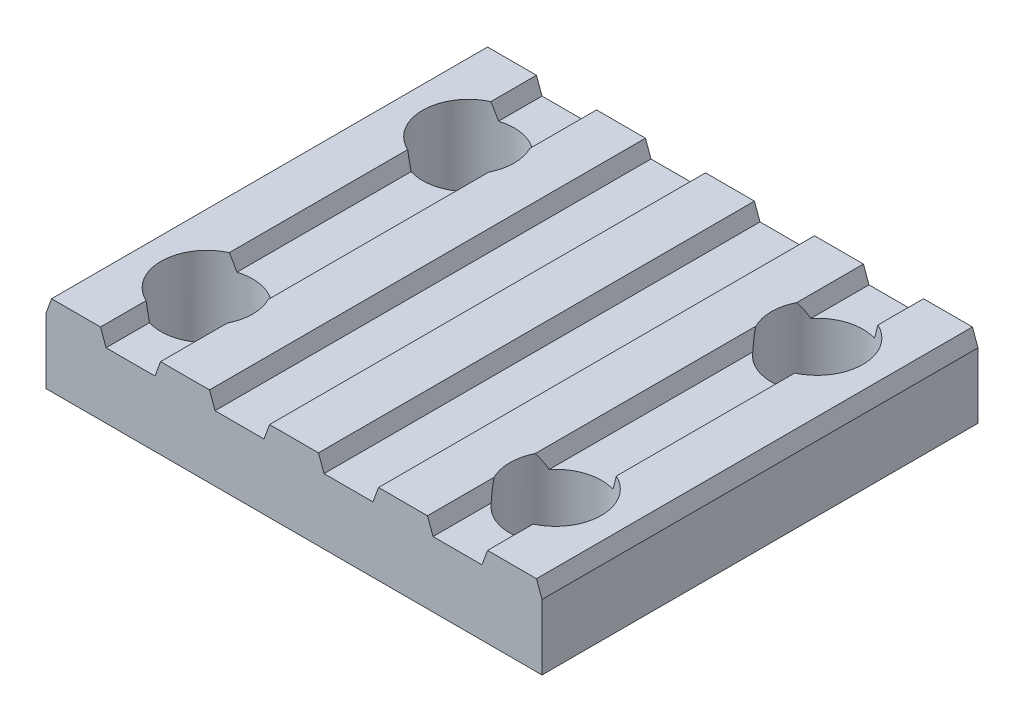
from build123d import *

# Parameters (mm, degrees)
BOSS_EXTRUDE1_DEPTH = 10
SKETCH2_R           = 2.1
CUT_EXTRUDE1_DEPTH  = 16.592786592


with BuildPart() as part:
    # Sketch1 → Boss-Extrude1 (new, symmetric)
    with BuildSketch(Plane.XY):
        Polygon((-11.377389582, 1.5), (-11.122610418, 2.2), (-8.877389582, 2.2), (-8.622610418, 1.5), (-6.377389582, 1.5), (-6.122610418, 2.2), (-3.877389582, 2.2), (-3.622610418, 1.5), (-1.377389582, 1.5), (-1.122610418, 2.2), (1.122610418, 2.2), (1.377389582, 1.5), (3.622610418, 1.5), (3.877389582, 2.2), (6.122610418, 2.2), (6.377389582, 1.5), (8.622610418, 1.5), (8.877389582, 2.2), (11.122610418, 2.2), (11.377389582, 1.5), (11.377389582, -1.5), (-11.377389582, -1.5), align=None)
    extrude(amount=BOSS_EXTRUDE1_DEPTH, both=True)

    # Sketch2 → Cut-Extrude1 (cut, through all)
    with BuildSketch(Plane.XZ.offset(1.5)):
        with Locations(Location((-8, -6, 0), (0, 0, 270))):
            Circle(SKETCH2_R)
        with Locations(Location((8, -6, 0), (0, 0, 287.246374966))):
            Circle(SKETCH2_R)
        with Locations(Location((8, 6, 0), (0, 0, 270))):
            Circle(SKETCH2_R)
        with Locations(Location((-8, 6, 0), (0, 0, 252.753625034))):
            Circle(SKETCH2_R)
    extrude(amount=-CUT_EXTRUDE1_DEPTH, mode=Mode.SUBTRACT)


solid = part.part
